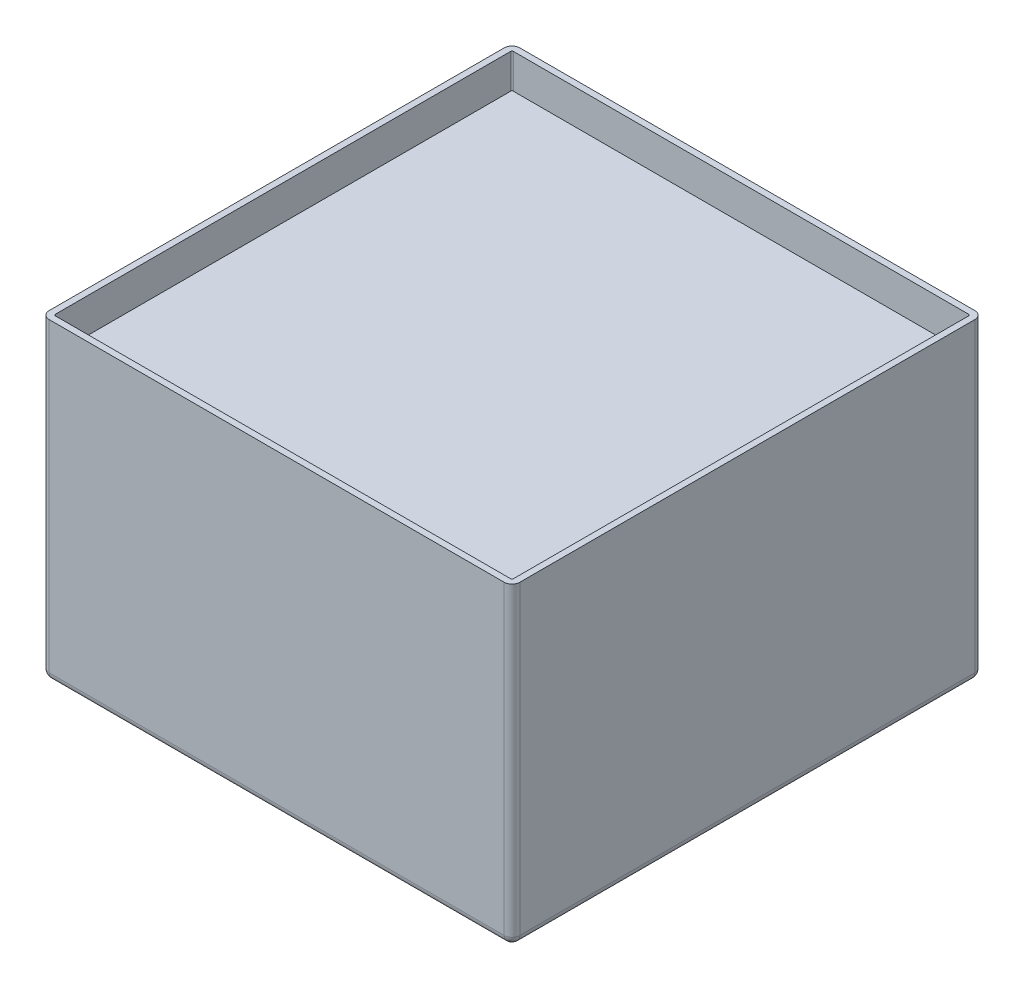
from build123d import *

# Parameters (mm, degrees)
CROQUIS1_W     = 600
CROQUIS1_H     = 600
EXTRUIR1_DEPTH = 400
REDONDEO1_R    = 10
VACIADO1_T     = -8
CROQUIS2_W     = 580
CROQUIS2_H     = 580
EXTRUIR2_DEPTH = 350


with BuildPart() as part:
    # Croquis1 → Extruir1 (new body)
    with BuildSketch(Plane(origin=(0, 0, 0), x_dir=(1, 0, 0), z_dir=(0, 1, 0))):
        Rectangle(CROQUIS1_W, CROQUIS1_H)
    extrude(amount=EXTRUIR1_DEPTH)

    # Redondeo1
    redondeo1_edges = [part.edges().sort_by_distance(p)[0] for p in [
        (0, 0, -300),
        (300, 0, 0),
        (0, 0, 300),
        (-300, 0, 0),
        (-300, 200, -300),
        (300, 200, -300),
        (300, 200, 300),
        (-300, 200, 300),
    ]]
    fillet(redondeo1_edges, radius=REDONDEO1_R)

    # Vaciado1
    vaciado1_openings = [part.faces().sort_by_distance(p)[0] for p in [
        (0, 400, 0),
    ]]
    offset(amount=VACIADO1_T, openings=vaciado1_openings, kind=Kind.INTERSECTION)


with BuildPart() as body_2:
    # Croquis2 → Extruir2 (new body)
    with BuildSketch(Plane(origin=(0, 8, 0), x_dir=(1, 0, 0), z_dir=(0, 1, 0))):
        Rectangle(CROQUIS2_W, CROQUIS2_H)
    extrude(amount=EXTRUIR2_DEPTH)


solid = Compound([part.part, body_2.part])
